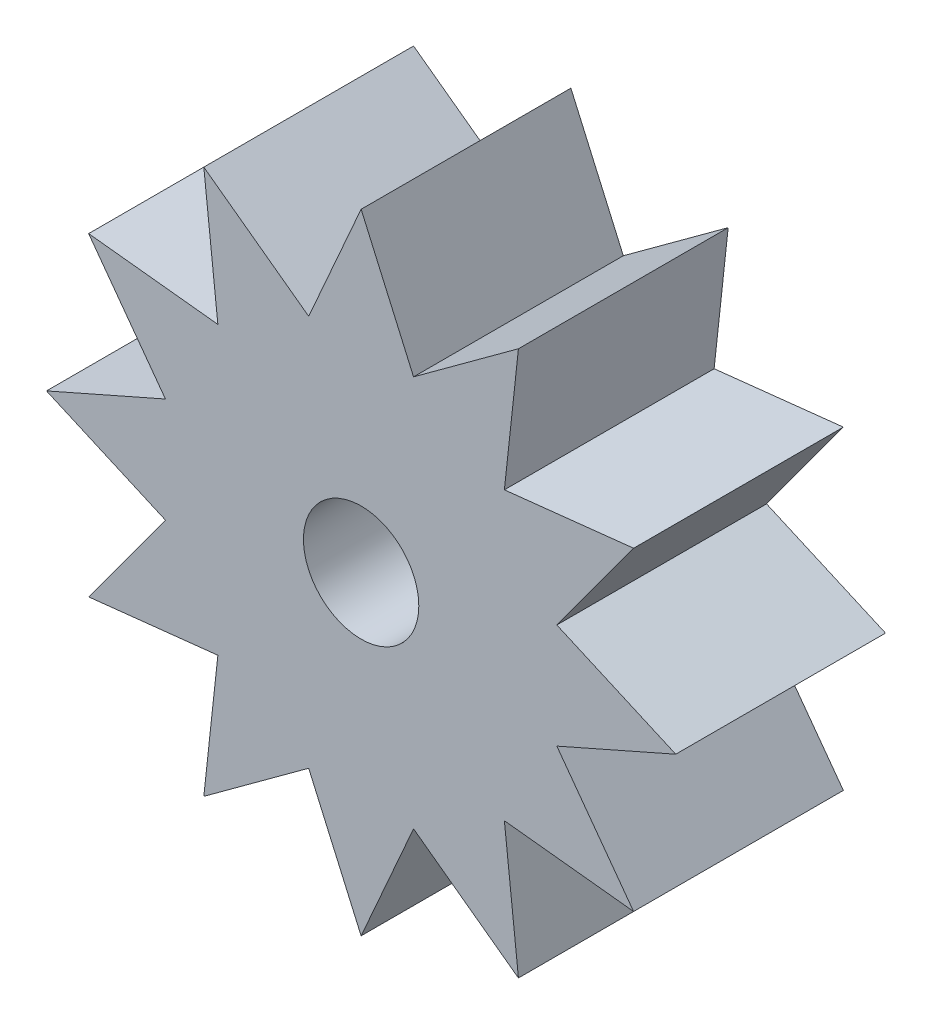
from build123d import *

# Parameters (mm, degrees)
SKETCH1_R           = 2.75
BOSS_EXTRUDE1_DEPTH = 10


with BuildPart() as part:
    # Sketch1 → Boss-Extrude1 (new body)
    with BuildSketch(Plane.XY):
        Polygon((7.5, -12.990381057), (2.5, -9.330127019), (0, -15), (-2.5, -9.330127019), (-7.5, -12.990381057), (-6.830127019, -6.830127019), (-12.990381057, -7.5), (-9.330127019, -2.5), (-15, 0), (-9.330127019, 2.5), (-12.990381057, 7.5), (-6.830127019, 6.830127019), (-7.5, 12.990381057), (-2.5, 9.330127019), (0, 15), (2.5, 9.330127019), (7.5, 12.990381057), (6.830127019, 6.830127019), (12.990381057, 7.5), (9.330127019, 2.5), (15, 0), (9.330127019, -2.5), (12.990381057, -7.5), (6.830127019, -6.830127019), align=None)
        Circle(SKETCH1_R, mode=Mode.SUBTRACT)
    extrude(amount=BOSS_EXTRUDE1_DEPTH)


solid = part.part
